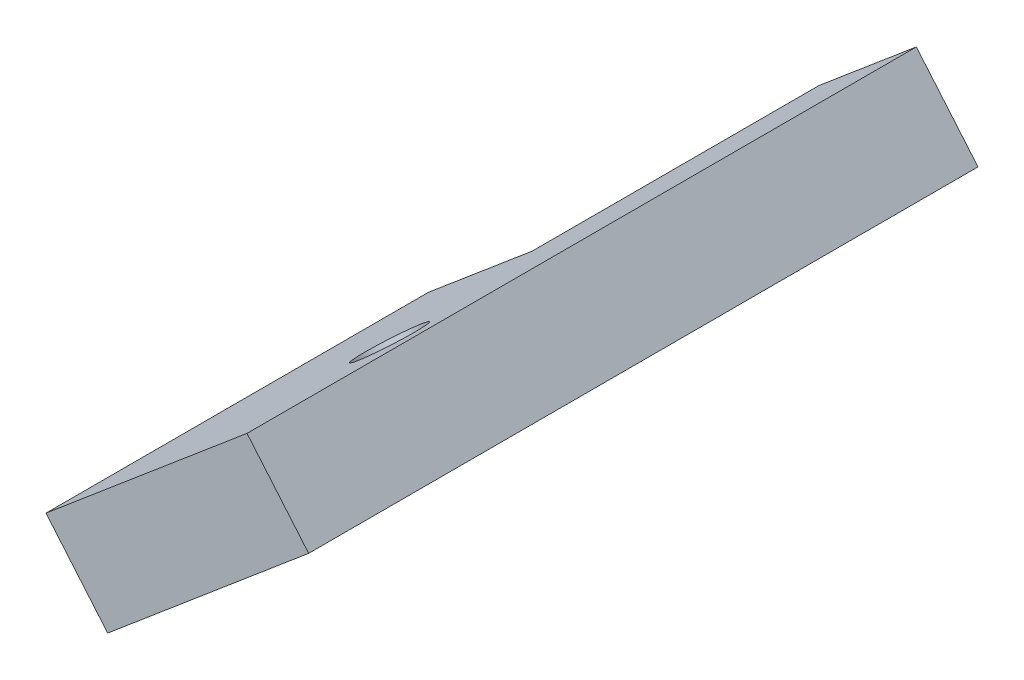
from build123d import *

# Parameters (mm, degrees)
SKETCH4_R           = 1
BOSS_EXTRUDE1_DEPTH = 3


with BuildPart() as part:
    # Sketch4 → Boss-Extrude1 (new body)
    with BuildSketch(Plane(origin=(454.145082272, -538.33265317, 0), x_dir=(0.7643426316132825, 0.6448103143549132, 0), z_dir=(0.6448103143549132, -0.7643426316132826, 0))):
        Polygon((554.951991089, 0), (554.951991089, 12), (546.701991089, 12), (546.701991089, 0), (550.951991089, 0), (550.951991089, -9), (554.951991089, -9), align=None)
        with Locations((552.951991089, 6)):
            Circle(SKETCH4_R, mode=Mode.SUBTRACT)
    extrude(amount=BOSS_EXTRUDE1_DEPTH)


solid = part.part
